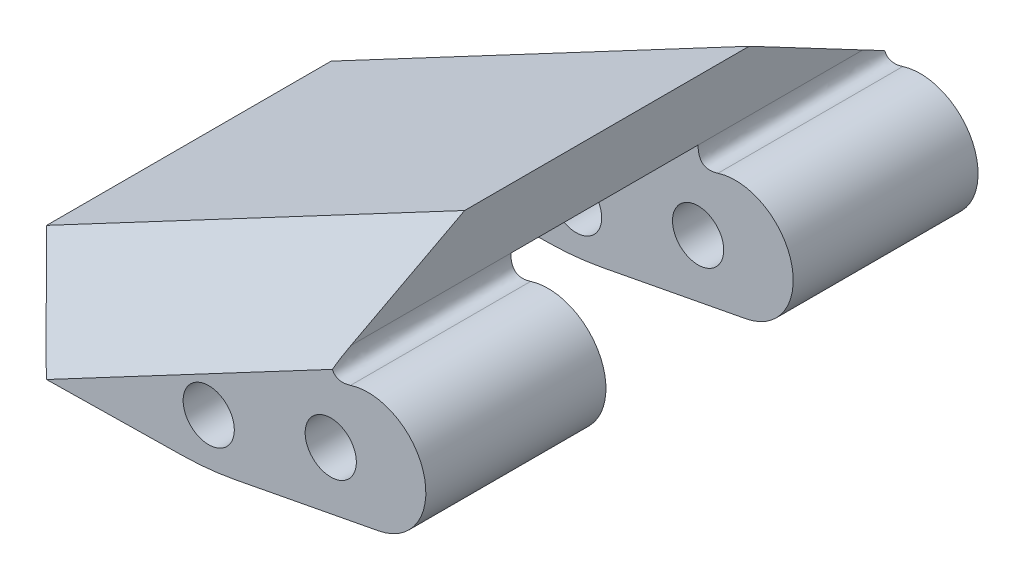
from build123d import *
from OCP.BRepFilletAPI import BRepFilletAPI_MakeChamfer

# Parameters (mm, degrees)
SKETCH1_R           = 1.0668
BOSS_EXTRUDE1_DEPTH = 7.5
BOSS_EXTRUDE2_DEPTH = 7.8
BOSS_EXTRUDE3_START = 7.7
SKETCH3_R           = 1.0668
BOSS_EXTRUDE3_DEPTH = 7.7
BOSS_EXTRUDE4_DEPTH = 23
CHAMFER1_SIZE       = 2.6
CHAMFER1_SIZE2      = 5.575717993


with BuildPart() as part:
    # Sketch1 → Boss-Extrude1 (new body)
    with BuildSketch(Plane.XY):
        with BuildLine():
            Line((0, 0), (6.519373857, 0.102105999))
            add(Edge.make_bspline(
                [(6.519373857, 0.102105999), (7.62, 0.119343933), (8.701246874, 0.325693755)],
                knots=[0, 0, 0, 1, 1, 1], degree=2))
            Line((8.701246874, 0.325693755), (14.703179453, 1.471128487))
            ThreePointArc((14.703179453, 1.471128487), (16.587758943, 4.427434521), (13.526155588, 6.135641216))
            add(Edge.make_bspline(
                [(13.526155588, 6.135641216), (12.7, 5.874844246), (12.7, 6.741186046)],
                knots=[0, 0, 0, 1, 1, 1], degree=2))
            Line((12.7, 6.741186046), (12.7, 9.241186046))
            Line((12.7, 9.241186046), (-4.709853694, 0))
            Line((-4.709853694, 0), (0, 0))
        make_face()
        with Locations((12.7, 3.481838658)):
            Circle(SKETCH1_R, mode=Mode.SUBTRACT)
        with Locations((7.617577591, 2.105666766)):
            Circle(SKETCH1_R, mode=Mode.SUBTRACT)
    extrude(amount=BOSS_EXTRUDE1_DEPTH)

    # Sketch2 → Boss-Extrude2 (add)
    with BuildSketch(Plane(origin=(0, 0, 0), x_dir=(-1, 0, 0), z_dir=(0, 0, -1))):
        Polygon((-12.7, 6.741186046), (4.709853694, 0), (-12.7, 9.241186046), align=None)
    extrude(amount=BOSS_EXTRUDE2_DEPTH)

    # Sketch3 → Boss-Extrude3 (add)
    with BuildSketch(Plane(origin=(0, 0, -7.8), x_dir=(-1, 0, 0), z_dir=(0, 0, -1)).offset(BOSS_EXTRUDE3_START)):
        with BuildLine():
            Line((-12.7, 9.241186046), (-12.7, 6.741186047))
            add(Edge.make_bspline(
                [(-12.7, 6.741186047), (-12.7, 5.874844247), (-13.526155587, 6.135641216)],
                knots=[0, 0, 0, 1, 1, 1], degree=2))
            ThreePointArc((-13.526155587, 6.135641216), (-16.587758943, 4.427434521), (-14.703179453, 1.471128487))
            Line((-14.703179453, 1.471128487), (-8.70124687, 0.325693755))
            add(Edge.make_bspline(
                [(-8.70124687, 0.325693755), (-7.619999998, 0.119343933), (-6.519373857, 0.102105999)],
                knots=[0, 0, 0, 1, 1, 1], degree=2))
            Line((-6.519373857, 0.102105999), (0, 0))
            Line((0, 0), (4.709853694, 0))
            Line((4.709853694, 0), (-12.7, 9.241186046))
        make_face()
        with Locations(Location((-12.7, 3.481838658, 0), (0, 0, 180))):
            Circle(SKETCH3_R, mode=Mode.SUBTRACT)
        with Locations(Location((-7.617577591, 2.105666766, 0), (0, 0, 180))):
            Circle(SKETCH3_R, mode=Mode.SUBTRACT)
    extrude(amount=-BOSS_EXTRUDE3_DEPTH)

    # Sketch4 → Boss-Extrude4 (add)
    with BuildSketch(Plane.XY.offset(7.5)):
        with BuildLine():
            Line((0, 0), (4.638040447, 0.072640681))
            ThreePointArc((4.638040447, 0.072640681), (2.936201023, 1.452503315), (3.995073153, 3.370593023))
            Line((3.995073153, 3.370593023), (3.995073153, 4.620593023))
            Line((3.995073153, 4.620593023), (-4.709853694, 0))
            Line((-4.709853694, 0), (0, 0))
        make_face()
    extrude(amount=-BOSS_EXTRUDE4_DEPTH)

    # Chamfer1: one chamfer whose edges measure the first distance from different faces: ONE call of the kernel's chamfer builder (chamfer() names one face for all edges)
    chamfer1_edges_1 = [part.edges().sort_by_distance(p)[0] for p in [
        (3.995073153, 4.620593023, 7.5),
    ]]
    chamfer1_side_1 = [part.faces().sort_by_distance(p)[0] for p in [
        (7.962373857, 3.352750827, 7.5),
    ]]
    chamfer1_edges_2 = [part.edges().sort_by_distance(p)[0] for p in [
        (3.995073153, 4.620593023, -15.5),
    ]]
    chamfer1_side_2 = [part.faces().sort_by_distance(p)[0] for p in [
        (7.962373857, 3.352750827, -15.5),
    ]]
    chamfer1 = BRepFilletAPI_MakeChamfer(part.part.solid().wrapped)
    for e in chamfer1_edges_1:
        chamfer1.Add(CHAMFER1_SIZE, CHAMFER1_SIZE2, e.wrapped, chamfer1_side_1[0].wrapped)  # the first distance lies on this face
    for e in chamfer1_edges_2:
        chamfer1.Add(CHAMFER1_SIZE, CHAMFER1_SIZE2, e.wrapped, chamfer1_side_2[0].wrapped)  # the first distance lies on this face
    add(Compound.cast(chamfer1.Shape()), mode=Mode.REPLACE)


solid = part.part
